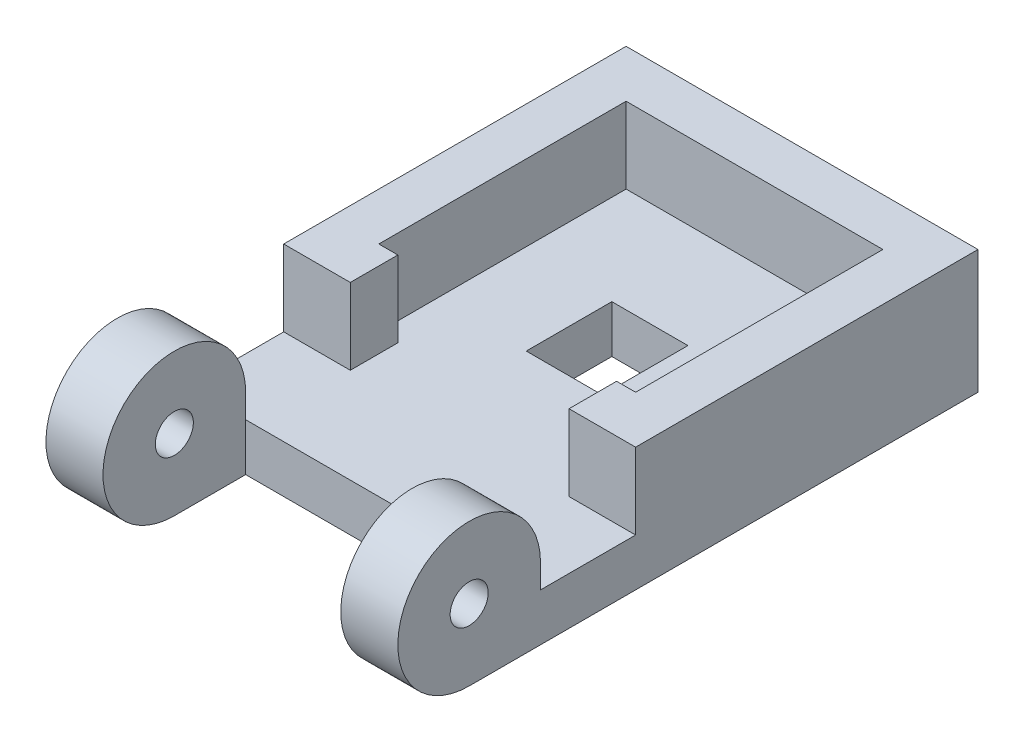
from build123d import *

# Parameters (mm, degrees)
SKIZZE1_W                            = 37
SKIZZE1_H                            = 46
SKIZZE1_W_2                          = 25
SKIZZE1_H_2                          = 24
SKIZZE1_W_3                          = 8
SKIZZE1_H_3                          = 9
AUFSATZ_LINEAR_AUSTRAGEN2_DEPTH      = 5
AUFSATZ_LINEAR_AUSTRAGEN3_DEPTH      = 8
AUFSATZ_LINEAR_AUSTRAGEN4_DEPTH      = 37
SCHNITT_LINEAR_AUSTRAGEN1_DEPTH      = 22
SCHNITT_LINEAR_AUSTRAGEN1_DEPTH_BACK = 11
SKIZZE4_W                            = 25
SKIZZE4_H                            = 15


with BuildPart() as part:
    # Skizze1 → Aufsatz-Linear austragen2 (new body)
    # profile 1 of 2: a face of its own
    with BuildSketch(Plane(origin=(0, 0, 0), x_dir=(1, 0, 0), z_dir=(0, 1, 0))):
        with Locations((0, -2.5)):
            Rectangle(SKIZZE1_W, SKIZZE1_H)
        with Locations((0, 2.5)):
            Rectangle(SKIZZE1_W_2, SKIZZE1_H_2, mode=Mode.SUBTRACT)
    # profile 2 of 2: a face of its own
    with BuildSketch(Plane(origin=(0, 0, 0), x_dir=(1, 0, 0), z_dir=(0, 1, 0))):
        with Locations((0, 2.5)):
            Rectangle(SKIZZE1_W_2, SKIZZE1_H_2)
        Rectangle(SKIZZE1_W_3, SKIZZE1_H_3, mode=Mode.SUBTRACT)
    extrude(amount=AUFSATZ_LINEAR_AUSTRAGEN2_DEPTH)

    # Skizze2 → Aufsatz-Linear austragen3 (add)
    with BuildSketch(Plane(origin=(0, 5, 0), x_dir=(1, 0, 0), z_dir=(0, 1, 0))):
        Polygon((-13.5, -10.5), (-13.5, 15.5), (13.5, 15.5), (13.5, -10.5), (18.5, -10.5), (18.5, 20.5), (-18.5, 20.5), (-18.5, -10.5), align=None)
        Polygon((-11.5, -10.5), (-13.5, -10.5), (-18.5, -10.5), (-18.5, -15.5), (-11.5, -15.5), align=None)
        Polygon((18.5, -10.5), (13.5, -10.5), (11.5, -10.5), (11.5, -15.5), (18.5, -15.5), align=None)
    extrude(amount=AUFSATZ_LINEAR_AUSTRAGEN3_DEPTH)

    # Skizze3 → Aufsatz-Linear austragen4 (add)
    with BuildSketch(Plane.ZY.offset(18.5)):
        with BuildLine():
            Line((25.5, 0), (33, 0))
            ThreePointArc((33, 0), (27.696699141, 2.196699141), (25.5, 7.5))
            Line((25.5, 7.5), (25.5, 5))
            Line((25.5, 5), (25.5, 0))
        make_face()
        with BuildLine():
            ThreePointArc((31, 7.5), (33, 9.5), (35, 7.5))
            Line((35, 7.5), (40.5, 7.5))
            ThreePointArc((40.5, 7.5), (38.303300859, 12.803300859), (33, 15))
            ThreePointArc((33, 15), (27.696699141, 12.803300859), (25.5, 7.5))
            Line((25.5, 7.5), (31, 7.5))
        make_face()
        with BuildLine():
            Line((40.5, 7.5), (35, 7.5))
            ThreePointArc((35, 7.5), (33, 5.5), (31, 7.5))
            Line((31, 7.5), (25.5, 7.5))
            ThreePointArc((25.5, 7.5), (27.696699141, 2.196699141), (33, 0))
            ThreePointArc((33, 0), (38.303300859, 2.196699141), (40.5, 7.5))
        make_face()
    extrude(amount=-AUFSATZ_LINEAR_AUSTRAGEN4_DEPTH)

    # Skizze4 → Schnitt-Linear austragen1 (cut, two sides: drawn at the far end of the back side and taken through both)
    with BuildSketch(Plane(origin=(0, 5, 0), x_dir=(1, 0, 0), z_dir=(0, 1, 0)).offset(-SCHNITT_LINEAR_AUSTRAGEN1_DEPTH_BACK)):
        with Locations((0, -33)):
            Rectangle(SKIZZE4_W, SKIZZE4_H)
    extrude(amount=SCHNITT_LINEAR_AUSTRAGEN1_DEPTH + SCHNITT_LINEAR_AUSTRAGEN1_DEPTH_BACK, mode=Mode.SUBTRACT)


solid = part.part
